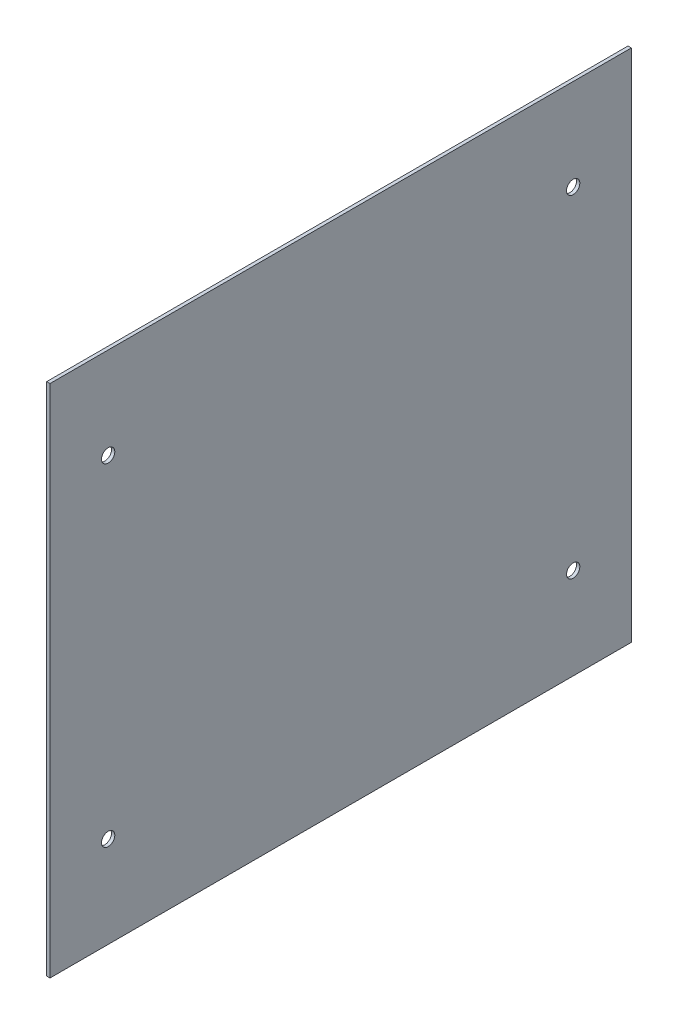
from build123d import *

# Parameters (mm, degrees)
SKETCH1_W           = 350
SKETCH1_H           = 310
BOSS_EXTRUDE1_DEPTH = 2
SKETCH2_R           = 4
CUT_EXTRUDE1_DEPTH  = 234.781949688


with BuildPart() as part:
    # Sketch1 → Boss-Extrude1 (new body)
    with BuildSketch(Plane(origin=(0, 0, 0), x_dir=(0, 0, -1), z_dir=(1, 0, 0))):
        Rectangle(SKETCH1_W, SKETCH1_H)
    extrude(amount=BOSS_EXTRUDE1_DEPTH)

    # Sketch2 → Cut-Extrude1 (cut, through all)
    with BuildSketch(Plane(origin=(2, 0, 0), x_dir=(0, 0, -1), z_dir=(1, 0, 0))):
        with Locations((-140, 100)):
            Circle(SKETCH2_R)
        with Locations(Location((-140, -100, 0), (0, 0, 180))):
            Circle(SKETCH2_R)
        with Locations((140, -100)):
            Circle(SKETCH2_R)
        with Locations(Location((140, 100, 0), (0, 0, 180))):
            Circle(SKETCH2_R)
    extrude(amount=-CUT_EXTRUDE1_DEPTH, mode=Mode.SUBTRACT)


solid = part.part
